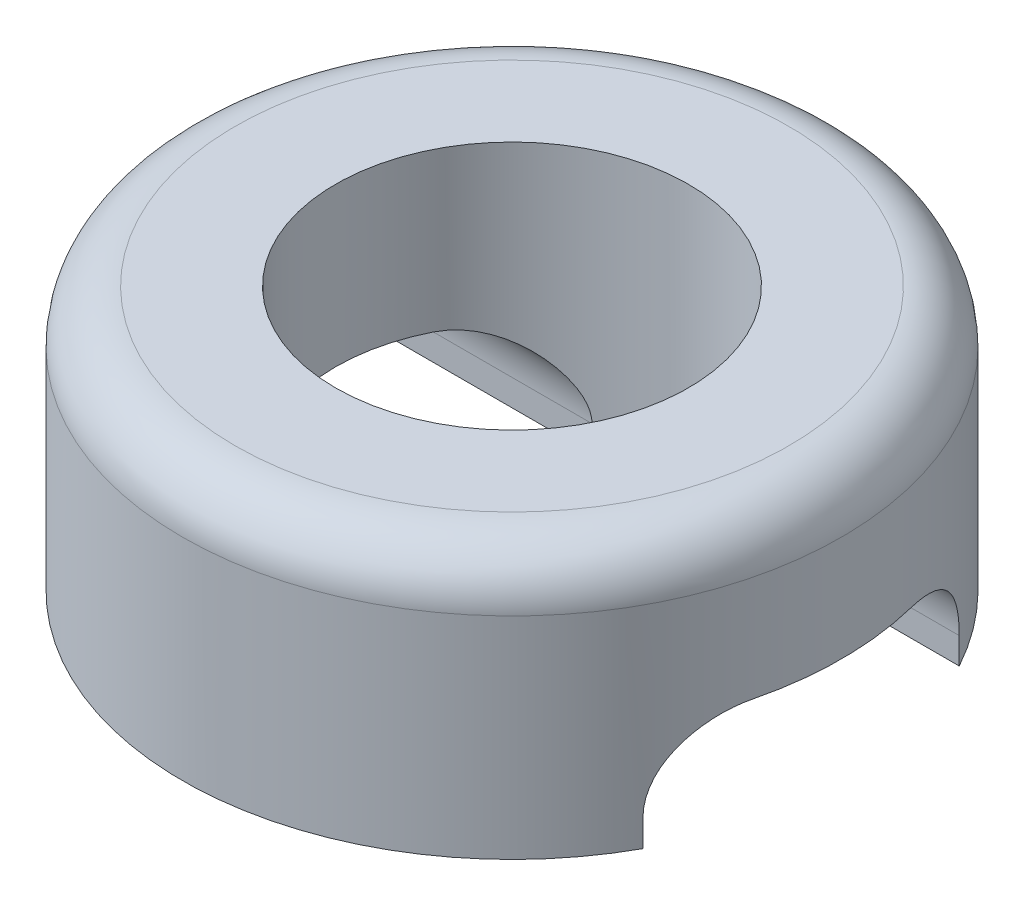
from build123d import *

# Parameters (mm, degrees)
SKETCH1_R               = 7.9375
SKETCH1_R_2             = 4.25
BOSS_EXTRUDE1_DEPTH     = 6.35
CUT_EXTRUDE1_DEPTH      = 13.896910967
CUT_EXTRUDE1_DEPTH_BACK = 13.896910967
SKETCH2_W               = 7.62
SKETCH2_H               = 2.54
FILLET2_R               = 1.905
FILLET3_R               = 1.27


with BuildPart() as part:
    # Sketch1 → Boss-Extrude1 (new body)
    with BuildSketch(Plane(origin=(0, 0, 0), x_dir=(1, 0, 0), z_dir=(0, 1, 0))):
        with Locations(Location((0, 0, 0), (0, 0, 270))):
            Circle(SKETCH1_R)
        with Locations(Location((0, 0, 0), (0, 0, 270))):
            Circle(SKETCH1_R_2, mode=Mode.SUBTRACT)
    extrude(amount=BOSS_EXTRUDE1_DEPTH)

    # Sketch2 → Cut-Extrude1 (cut, two sides: drawn at the far end of the back side and taken through both)
    with BuildSketch(Plane(origin=(0, 0, 0), x_dir=(0, 0, -1), z_dir=(1, 0, 0)).offset(-CUT_EXTRUDE1_DEPTH_BACK)):
        with Locations((0, 1.27)):
            Rectangle(SKETCH2_W, SKETCH2_H)
    extrude(amount=CUT_EXTRUDE1_DEPTH + CUT_EXTRUDE1_DEPTH_BACK, mode=Mode.SUBTRACT)

    # Fillet2
    fillet2_edges = [part.edges().sort_by_distance(p)[0] for p in [
        (4.423253704, 2.54, 3.81),
        (-4.423253704, 2.54, 3.81),
        (4.423253704, 2.54, -3.81),
        (-4.423253704, 2.54, -3.81),
    ]]
    fillet(fillet2_edges, radius=FILLET2_R)

    # Fillet3
    fillet3_edges = [part.edges().sort_by_distance(p)[0] for p in [
        (0, 6.35, -7.9375),
    ]]
    fillet(fillet3_edges, radius=FILLET3_R)


solid = part.part
